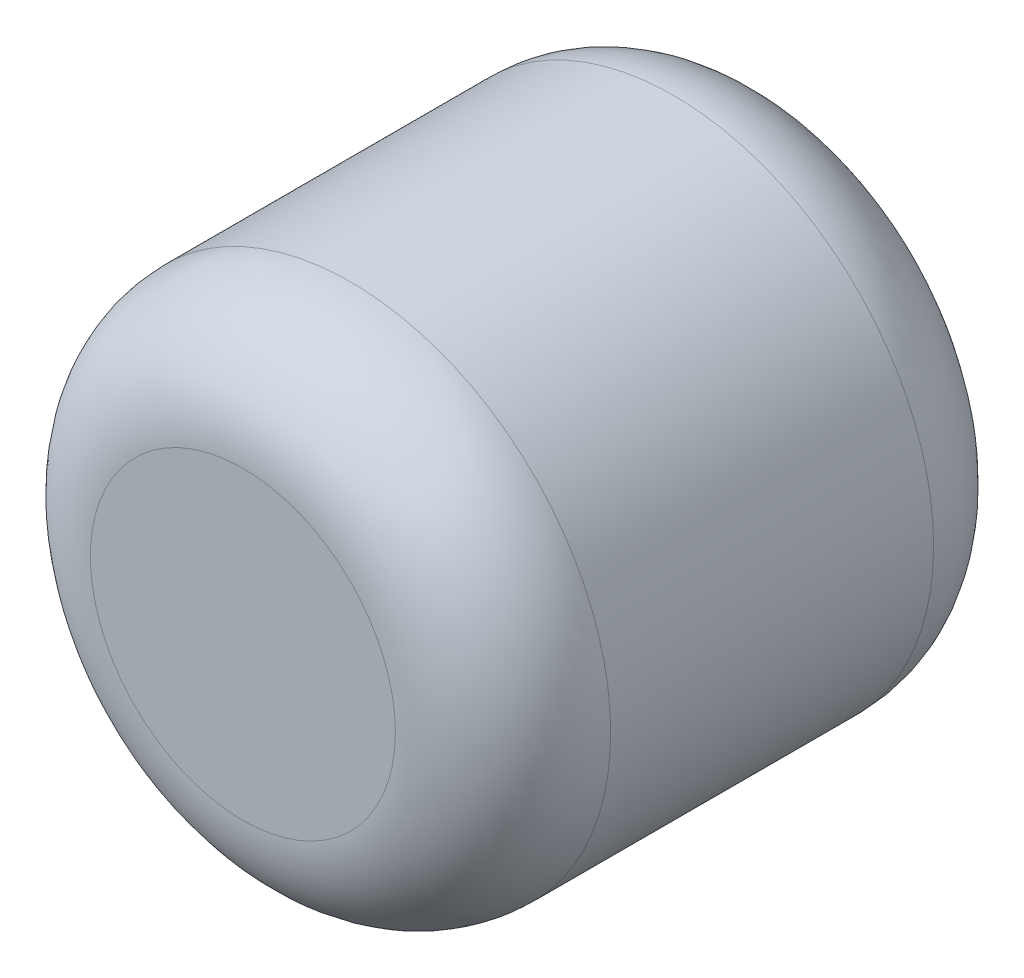
from build123d import *

# Parameters (mm, degrees)
SKETCH2_R           = 7.25
BOSS_EXTRUDE1_DEPTH = 15
FILLET1_R           = 3


with BuildPart() as part:
    # Sketch2 → Boss-Extrude1 (new body)
    with BuildSketch(Plane.XY):
        Circle(SKETCH2_R)
    extrude(amount=BOSS_EXTRUDE1_DEPTH)

    # Fillet1
    fillet1_edges = [part.edges().sort_by_distance(p)[0] for p in [
        (-7.25, 0, 0),
        (-7.25, 0, 15),
    ]]
    fillet(fillet1_edges, radius=FILLET1_R)


solid = part.part
